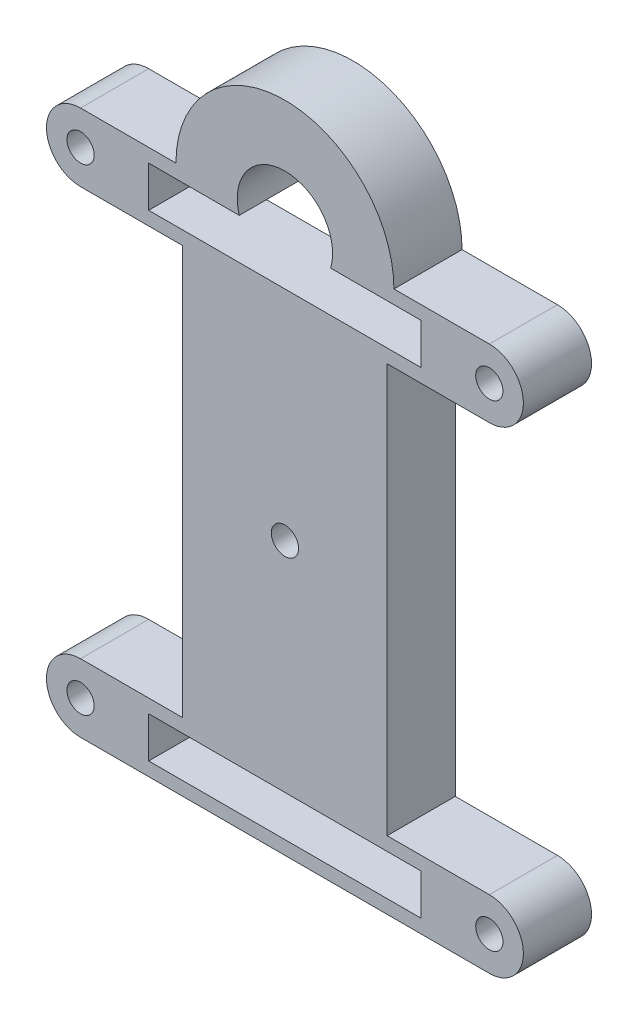
from build123d import *

# Parameters (mm, degrees)
SKETCH1_R           = 1
SKETCH1_R_2         = 3.5
BOSS_EXTRUDE2_DEPTH = 2.5
SKETCH2_R           = 1
SKETCH2_W           = 20
SKETCH2_H           = 3
CUT_EXTRUDE1_DEPTH  = 34.395358959


with BuildPart() as part:
    # Sketch1 → Boss-Extrude2 (new, symmetric)
    with BuildSketch(Plane.XY):
        with BuildLine():
            Line((7.5, 15), (15, 15))
            ThreePointArc((15, 15), (17.5, 17.5), (15, 20))
            Line((15, 20), (8, 20))
            ThreePointArc((8, 20), (0, 28), (-8, 20))
            Line((-8, 20), (-15, 20))
            ThreePointArc((-15, 20), (-17.5, 17.5), (-15, 15))
            Line((-15, 15), (-7.5, 15))
            Line((-7.5, 15), (-7.5, -15))
            Line((-7.5, -15), (-15, -15))
            ThreePointArc((-15, -15), (-17.5, -17.5), (-15, -20))
            Line((-15, -20), (15, -20))
            ThreePointArc((15, -20), (17.5, -17.5), (15, -15))
            Line((15, -15), (7.5, -15))
            Line((7.5, -15), (7.5, 15))
        make_face()
        with Locations((-15, 17.5)):
            Circle(SKETCH1_R, mode=Mode.SUBTRACT)
        with Locations((15, 17.5)):
            Circle(SKETCH1_R, mode=Mode.SUBTRACT)
        with Locations(Location((15, -17.5, 0), (0, 0, 180))):
            Circle(SKETCH1_R, mode=Mode.SUBTRACT)
        with Locations(Location((-15, -17.5, 0), (0, 0, 180))):
            Circle(SKETCH1_R, mode=Mode.SUBTRACT)
        with Locations((0, 20)):
            Circle(SKETCH1_R_2, mode=Mode.SUBTRACT)
    extrude(amount=BOSS_EXTRUDE2_DEPTH, both=True)

    # Sketch2 → Cut-Extrude1 (cut, through all)
    with BuildSketch(Plane.XY.offset(2.5)):
        Circle(SKETCH2_R)
        with Locations((0, 17.5)):
            Rectangle(SKETCH2_W, SKETCH2_H)
        with Locations((0, -17.5)):
            Rectangle(SKETCH2_W, SKETCH2_H)
    extrude(amount=-CUT_EXTRUDE1_DEPTH, mode=Mode.SUBTRACT)


solid = part.part
